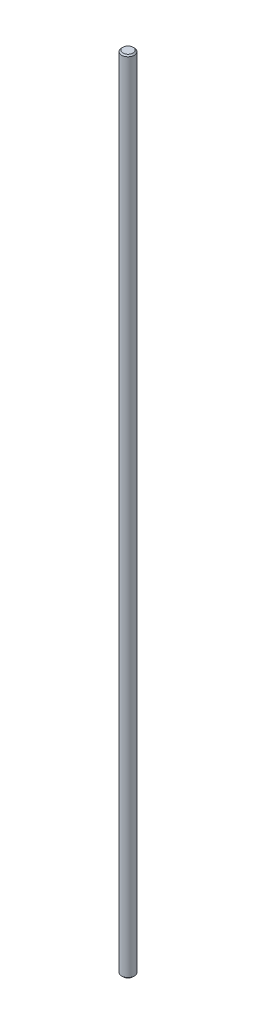
from build123d import *

# Parameters (mm, degrees)
SKETCH1_R           = 2.5
BOSS_EXTRUDE1_DEPTH = 157.5
CHAMFER1_SIZE       = 0.5


with BuildPart() as part:
    # Sketch1 → Boss-Extrude1 (new, symmetric)
    with BuildSketch(Plane(origin=(0, 0, 0), x_dir=(1, 0, 0), z_dir=(0, 1, 0))):
        Circle(SKETCH1_R)
    extrude(amount=BOSS_EXTRUDE1_DEPTH, both=True)

    # Chamfer1
    chamfer1_edges = [part.edges().sort_by_distance(p)[0] for p in [
        (-2.5, -157.5, 0),
        (-2.5, 157.5, 0),
    ]]
    chamfer(chamfer1_edges, length=CHAMFER1_SIZE)


solid = part.part
